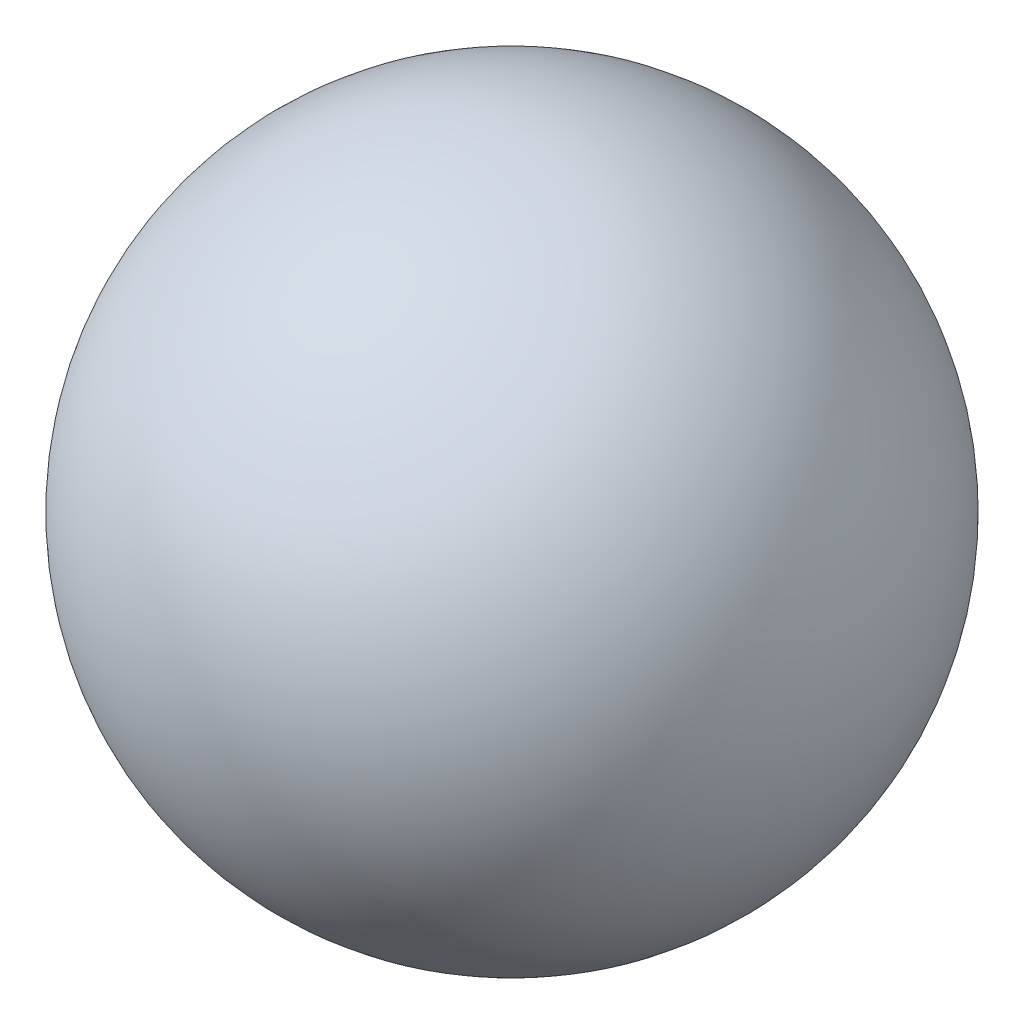
from build123d import *


with BuildPart() as part:
    # Sketch1 → Revolve1 (revolve)
    with BuildSketch(Plane.XY):
        with BuildLine():
            ThreePointArc((0, 12.7), (12.7, 0), (0, -12.7))
            Line((0, -12.7), (0, 12.7))
        make_face()
    revolve(axis=Axis((0, -12.7, 0), (0, 1, 0)))


solid = part.part
